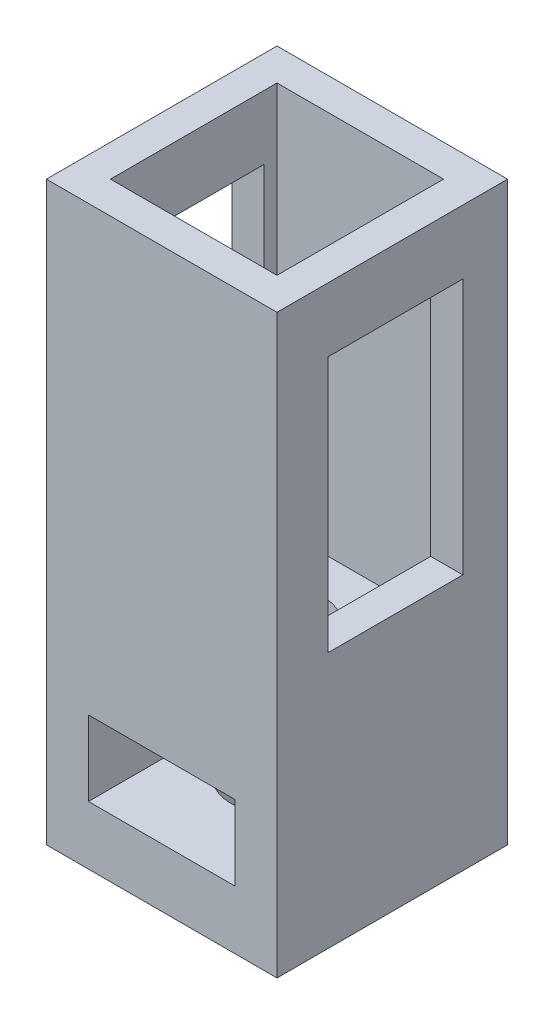
from build123d import *

# Parameters (mm, degrees)
SKETCH1_W                   = 18
SKETCH1_H                   = 18
BOSS_EXTRUDE1_DEPTH         = 35
SKETCH5_W                   = 13
SKETCH5_H                   = 13
CUT_EXTRUDE1_DEPTH          = 30
SKETCH7_W                   = 10.5
SKETCH7_H                   = 20
CUT_EXTRUDE3_DEPTH          = 44.278170017
SKETCH8_W                   = 18
SKETCH8_H                   = 18
BOSS_EXTRUDE2_DEPTH         = 10
SKETCH9_W                   = 11.43
SKETCH9_H                   = 5.85
CUT_EXTRUDE4_DEPTH          = 44.278170017
F_1_4_CLEARANCE_HOLE1_D     = 7.14248
F_1_4_CLEARANCE_HOLE1_DEPTH = 15
F_1_4_CLEARANCE_HOLE1_TIP   = 2.145817477


with BuildPart() as part:
    # Sketch1 → Boss-Extrude1 (new body)
    with BuildSketch(Plane(origin=(0, 0, 0), x_dir=(1, 0, 0), z_dir=(0, 1, 0))):
        with Locations((9, 9)):
            Rectangle(SKETCH1_W, SKETCH1_H)
    extrude(amount=BOSS_EXTRUDE1_DEPTH)

    # Sketch5 → Cut-Extrude1 (cut)
    with BuildSketch(Plane(origin=(0, 35, 0), x_dir=(1, 0, 0), z_dir=(0, 1, 0))):
        with Locations((9, 9)):
            Rectangle(SKETCH5_W, SKETCH5_H)
    extrude(amount=-CUT_EXTRUDE1_DEPTH, mode=Mode.SUBTRACT)

    # Sketch7 → Cut-Extrude3 (cut, through all)
    with BuildSketch(Plane(origin=(18, 0, 0), x_dir=(0, 0, -1), z_dir=(1, 0, 0))):
        with Locations((9.25, 20)):
            Rectangle(SKETCH7_W, SKETCH7_H)
    extrude(amount=-CUT_EXTRUDE3_DEPTH, mode=Mode.SUBTRACT)

    # Sketch8 → Boss-Extrude2 (add)
    with BuildSketch(Plane.XZ):
        with Locations((9, -9)):
            Rectangle(SKETCH8_W, SKETCH8_H)
    extrude(amount=BOSS_EXTRUDE2_DEPTH)

    # Sketch9 → Cut-Extrude4 (cut, through all)
    with BuildSketch(Plane.XY):
        with Locations((9, -2.5)):
            Rectangle(SKETCH9_W, SKETCH9_H)
    extrude(amount=-CUT_EXTRUDE4_DEPTH, mode=Mode.SUBTRACT)

    # 1/4 Clearance Hole1
    with Locations(Plane(origin=(0, -10, 0), x_dir=(-1, 0, 0), z_dir=(0, -1, 0))):
        with Locations((-9, 9)):
            Hole(F_1_4_CLEARANCE_HOLE1_D / 2, depth=F_1_4_CLEARANCE_HOLE1_DEPTH)
            with Locations((0, 0, -(F_1_4_CLEARANCE_HOLE1_DEPTH + F_1_4_CLEARANCE_HOLE1_TIP / 2))):  # 118° drill point
                Cone(0, F_1_4_CLEARANCE_HOLE1_D / 2, F_1_4_CLEARANCE_HOLE1_TIP, mode=Mode.SUBTRACT)


solid = part.part
